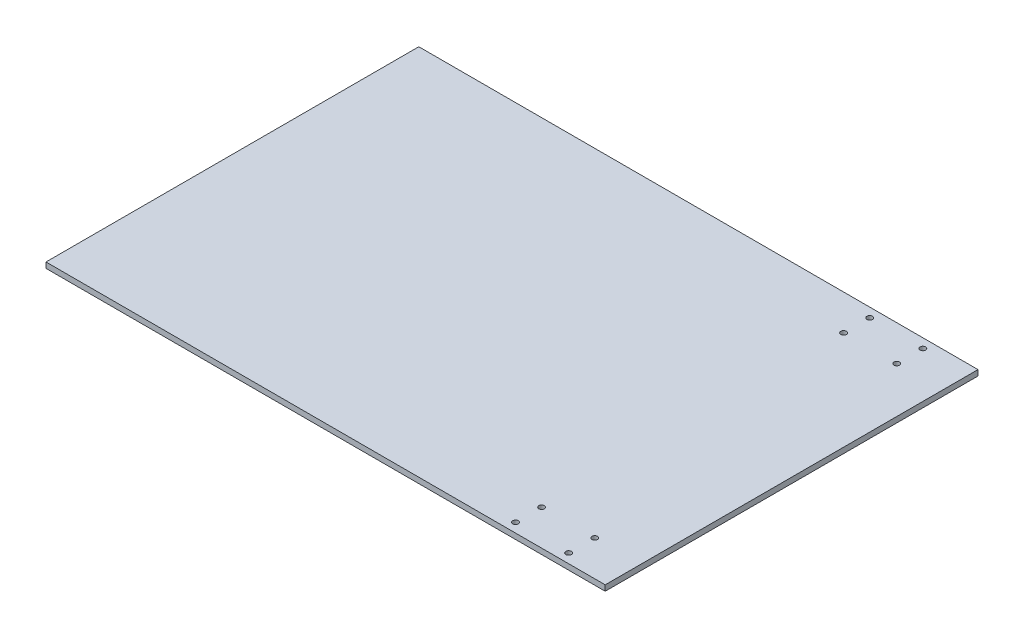
from build123d import *

# Parameters (mm, degrees)
SKETCH2_W           = 300
SKETCH2_H           = 200
BOSS_EXTRUDE1_DEPTH = 3
SKETCH3_R           = 1.5
CUT_EXTRUDE1_DEPTH  = 361.567608085


with BuildPart() as part:
    # Sketch2 → Boss-Extrude1 (new body)
    with BuildSketch(Plane(origin=(0, 0, 0), x_dir=(1, 0, 0), z_dir=(0, 1, 0))):
        with Locations((150, 100)):
            Rectangle(SKETCH2_W, SKETCH2_H)
    extrude(amount=BOSS_EXTRUDE1_DEPTH)

    # Sketch3 → Cut-Extrude1 (cut, through all)
    with BuildSketch(Plane(origin=(0, 3, 0), x_dir=(1, 0, 0), z_dir=(0, 1, 0))):
        with Locations(Location((275.4, 195, 0), (0, 0, 90))):
            Circle(SKETCH3_R)
        with Locations(Location((246.9, 195, 0), (0, 0, 270))):
            Circle(SKETCH3_R)
        with Locations(Location((275.4, 181, 0), (0, 0, 270))):
            Circle(SKETCH3_R)
        with Locations(Location((246.9, 181, 0), (0, 0, 270))):
            Circle(SKETCH3_R)
        with Locations(Location((275.4, 19, 0), (0, 0, 90))):
            Circle(SKETCH3_R)
        with Locations(Location((275.4, 5, 0), (0, 0, 270))):
            Circle(SKETCH3_R)
        with Locations(Location((246.9, 5, 0), (0, 0, 90))):
            Circle(SKETCH3_R)
        with Locations(Location((246.9, 19, 0), (0, 0, 90))):
            Circle(SKETCH3_R)
    extrude(amount=-CUT_EXTRUDE1_DEPTH, mode=Mode.SUBTRACT)


solid = part.part
